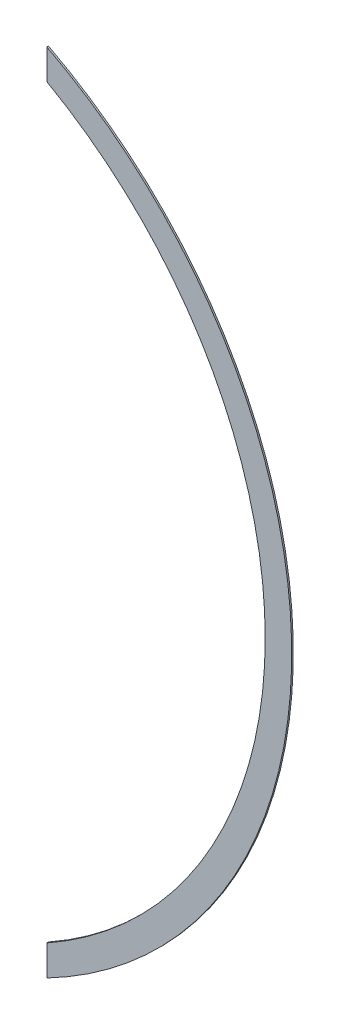
from build123d import *

# Parameters (mm, degrees)
BOSS_EXTRUDE1_DEPTH = 1.5


with BuildPart() as part:
    # Sketch1 → Boss-Extrude1 (new body)
    with BuildSketch(Plane.XY):
        with BuildLine():
            Line((-107.452220054, -370.281164629), (-107.452220054, -341.872107136))
            ThreePointArc((-107.452220054, -341.872107136), (96.84322007, 6.982769917), (-107.452220054, 355.83764697))
            Line((-107.452220054, 355.83764697), (-107.452220054, 384.017607549))
            ThreePointArc((-107.452220054, 384.017607549), (121.631112527, 6.86822146), (-107.452220054, -370.281164629))
        make_face()
    extrude(amount=BOSS_EXTRUDE1_DEPTH)


solid = part.part
